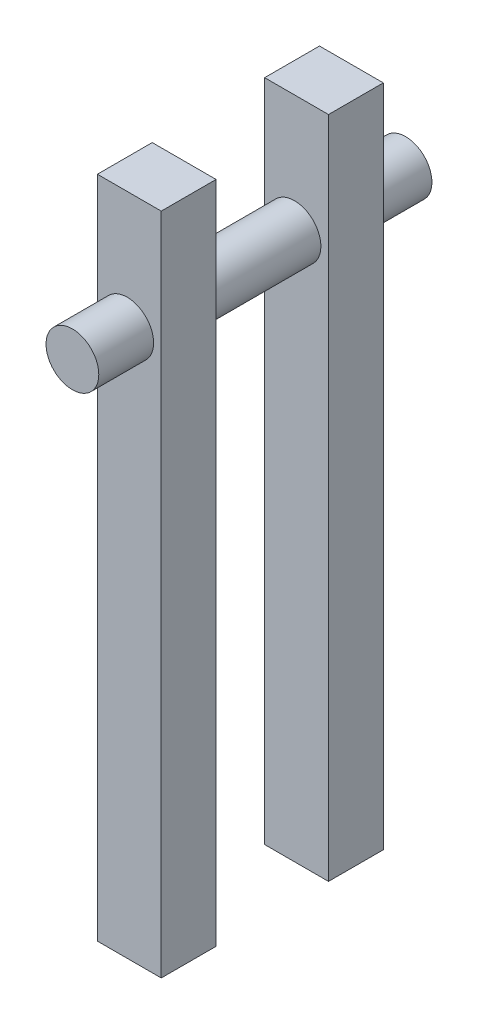
from build123d import *

# Parameters (mm, degrees)
SKETCH1_W                = 7.9
SKETCH1_H                = 95.7
BOSS_EXTRUDE1_DEPTH      = 9.2
SKETCH1_3_W              = 7.9
SKETCH1_3_H              = 95.7
BOSS_EXTRUDE2_DEPTH      = 9.2
BOSS_EXTRUDE3_DEPTH      = 32
BOSS_EXTRUDE3_DEPTH_BACK = 16
SKETCH2_R                = 3.8


with BuildPart() as part:
    # Sketch1 → Boss-Extrude1 (new body)
    with BuildSketch(Plane(origin=(0, 0, 0), x_dir=(0, 0, -1), z_dir=(1, 0, 0))):
        with Locations((-28.171698113, -0.670754717)):
            Rectangle(SKETCH1_W, SKETCH1_H)
    extrude(amount=BOSS_EXTRUDE1_DEPTH)

    # Sketch1<3> → Boss-Extrude2 (add)
    with BuildSketch(Plane(origin=(0, 0, 0), x_dir=(0, 0, -1), z_dir=(1, 0, 0))):
        with Locations((-28.171698113, -0.670754717)):
            Rectangle(SKETCH1_3_W, SKETCH1_3_H)
        with Locations((-4.071698113, -0.670754717)):
            Rectangle(SKETCH1_3_W, SKETCH1_3_H)
    extrude(amount=BOSS_EXTRUDE2_DEPTH)


with BuildPart() as boss_extrude2_piece_1:
    # of the separate pieces the step leaves, piece 1, a body of its own (boss_extrude2_pieces)
    add(part.part.solids().sort_by_distance((0, 47.179245283, 8.021698113))[0])



with BuildPart() as boss_extrude2_piece_2:
    # of the separate pieces the step leaves, piece 2, a body of its own (boss_extrude2_pieces)
    add(part.part.solids().sort_by_distance((0, 47.179245283, 32.121698113))[0])


with BuildPart() as boss_extrude2_piece_1_1:
    add(boss_extrude2_piece_1.part)

    add(boss_extrude2_piece_2.part)  # Boss-Extrude3 merges Boss-Extrude2 piece 2
    # Sketch2 → Boss-Extrude3 (add, two sides: drawn at the far end of the back side and taken through both)
    with BuildSketch(Plane.XY.offset(8.021698113).offset(-BOSS_EXTRUDE3_DEPTH_BACK)):
        with Locations((4.3, 30.179245283)):
            Circle(SKETCH2_R)
    extrude(amount=BOSS_EXTRUDE3_DEPTH + BOSS_EXTRUDE3_DEPTH_BACK)


solid = boss_extrude2_piece_1_1.part
